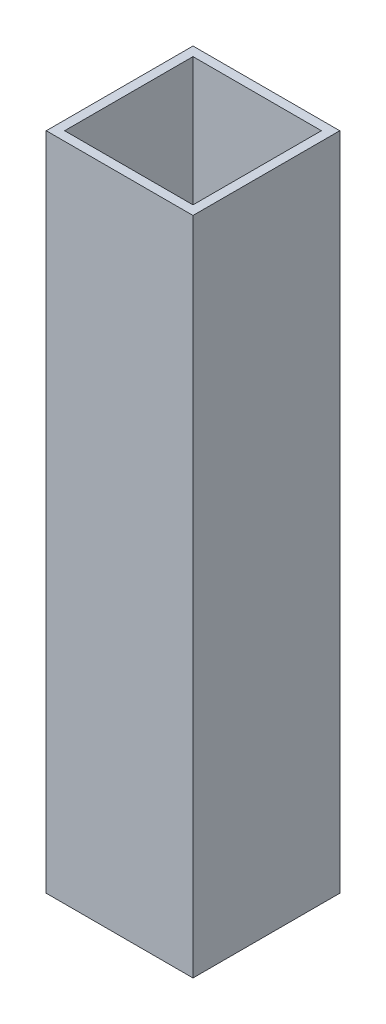
from build123d import *

# Parameters (mm, degrees)
SKETCH1_W           = 25.4
SKETCH1_H           = 25.4
SKETCH1_W_2         = 22.225
SKETCH1_H_2         = 22.225
BOSS_EXTRUDE1_DEPTH = 114.3


with BuildPart() as part:
    # Sketch1 → Boss-Extrude1 (new body)
    with BuildSketch(Plane(origin=(0, 0, 0), x_dir=(1, 0, 0), z_dir=(0, 1, 0))):
        Rectangle(SKETCH1_W, SKETCH1_H)
        Rectangle(SKETCH1_W_2, SKETCH1_H_2, mode=Mode.SUBTRACT)
    extrude(amount=BOSS_EXTRUDE1_DEPTH)


solid = part.part
